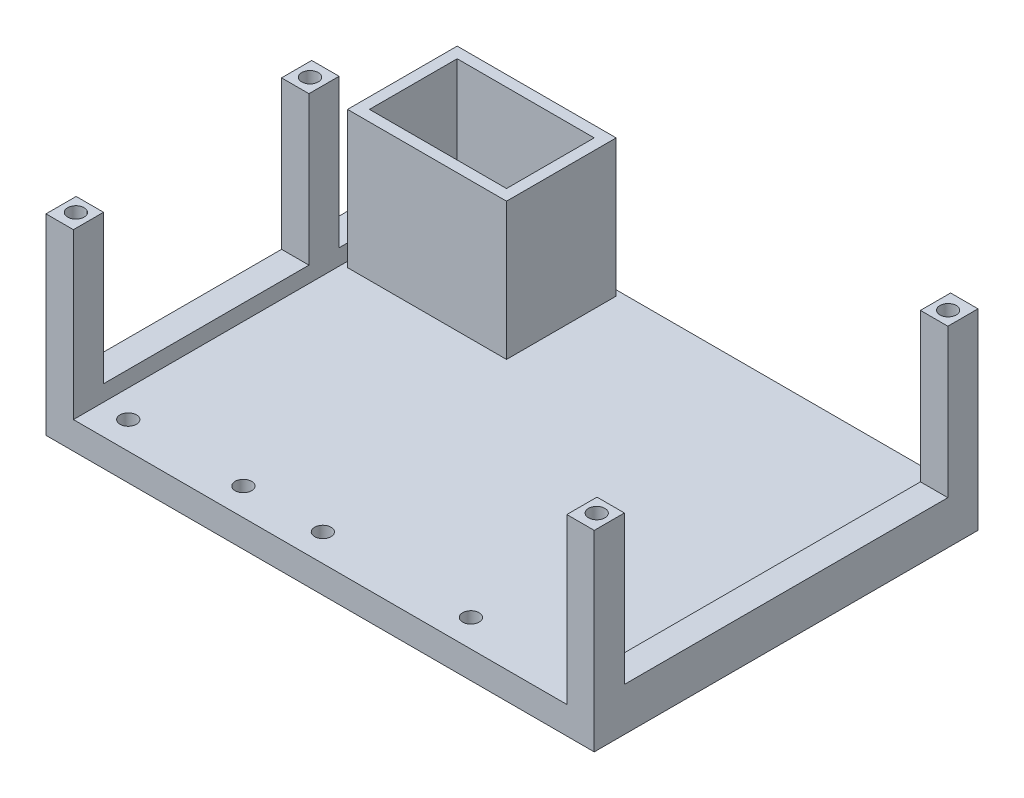
from build123d import *

# Parameters (mm, degrees)
SKETCH1_W               = 90
SKETCH1_H               = 70
BOSS_EXTRUDE1_DEPTH     = 2
SKETCH2_W               = 90
SKETCH2_H               = 70
BOSS_EXTRUDE2_DEPTH     = 5
CUT_EXTRUDE2_START      = -2
SKETCH3_R               = 1.5
CUT_EXTRUDE2_DEPTH      = 5
SKETCH9_W               = 5
SKETCH9_H               = 70
BOSS_EXTRUDE6_DEPTH     = 2
SKETCH9_2_W             = 5
SKETCH9_2_H             = 70
BOSS_EXTRUDE7_DEPTH     = 30
SKETCH11_R              = 1.5
CUT_EXTRUDE6_DEPTH      = 69.007352544
CUT_EXTRUDE7_DEPTH      = 111.675200474
CUT_EXTRUDE7_DEPTH_BACK = 10
BOSS_EXTRUDE8_START     = -2
SKETCH12_W              = 29
SKETCH12_H              = 20
BOSS_EXTRUDE8_DEPTH     = 25
SKETCH13_W              = 25
SKETCH13_H              = 16
CUT_EXTRUDE8_DEPTH      = 25
SKETCH14_W              = 21.535675489
SKETCH14_H              = 27.087328124
SKETCH14_W_2            = 37.464324511
CUT_EXTRUDE9_DEPTH      = 25
SKETCH15_R              = 1.5
CUT_EXTRUDE10_DEPTH     = 25
BOSS_EXTRUDE9_START     = -3
SKETCH16_W              = 5
SKETCH16_H              = 70
BOSS_EXTRUDE9_DEPTH     = 3


with BuildPart() as part:
    # Sketch1 → Boss-Extrude1 (new body)
    with BuildSketch(Plane(origin=(0, 0, 0), x_dir=(1, 0, 0), z_dir=(0, 1, 0))):
        Rectangle(SKETCH1_W, SKETCH1_H)
    extrude(amount=BOSS_EXTRUDE1_DEPTH)

    # Sketch2 → Boss-Extrude2 (add)
    with BuildSketch(Plane(origin=(0, 2, 0), x_dir=(1, 0, 0), z_dir=(0, 1, 0))):
        Rectangle(SKETCH2_W, SKETCH2_H)
    extrude(amount=-BOSS_EXTRUDE2_DEPTH)

    # Sketch3 → Cut-Extrude2 (cut)
    with BuildSketch(Plane.XZ.offset(CUT_EXTRUDE2_START)):
        with Locations(Location((-40, 30, 0), (0, 0, 90))):
            Circle(SKETCH3_R)
        with Locations(Location((-19, 30, 0), (0, 0, 90))):
            Circle(SKETCH3_R)
        with Locations(Location((-4.5, 30, 0), (0, 0, 90))):
            Circle(SKETCH3_R)
        with Locations(Location((22.5, 30, 0), (0, 0, 90))):
            Circle(SKETCH3_R)
    extrude(amount=CUT_EXTRUDE2_DEPTH, mode=Mode.SUBTRACT)

    # Sketch9 → Boss-Extrude6 (add)
    with BuildSketch(Plane(origin=(0, 2, 0), x_dir=(1, 0, 0), z_dir=(0, 1, 0))):
        with Locations((-47.5, 0)):
            Rectangle(SKETCH9_W, SKETCH9_H)
        with Locations((47.5, 0)):
            Rectangle(SKETCH9_W, SKETCH9_H)
    extrude(amount=-BOSS_EXTRUDE6_DEPTH)

    # Sketch9<2> → Boss-Extrude7 (add)
    with BuildSketch(Plane(origin=(0, 2, 0), x_dir=(1, 0, 0), z_dir=(0, 1, 0))):
        with Locations((-47.5, 0)):
            Rectangle(SKETCH9_2_W, SKETCH9_2_H)
        with Locations((47.5, 0)):
            Rectangle(SKETCH9_2_W, SKETCH9_2_H)
    extrude(amount=BOSS_EXTRUDE7_DEPTH)

    # Sketch11 → Cut-Extrude6 (cut, through all)
    with BuildSketch(Plane(origin=(0, 2, 0), x_dir=(1, 0, 0), z_dir=(0, 1, 0))):
        with Locations(Location((-47.5, -32.049006617, 0), (0, 0, 270))):
            Circle(SKETCH11_R)
        with Locations(Location((-47.5, 32.049006617, 0), (0, 0, 90))):
            Circle(SKETCH11_R)
        with Locations(Location((47.5, 32.049006617, 0), (0, 0, 270))):
            Circle(SKETCH11_R)
        with Locations(Location((47.5, -32.049006617, 0), (0, 0, 90))):
            Circle(SKETCH11_R)
    extrude(amount=CUT_EXTRUDE6_DEPTH, mode=Mode.SUBTRACT)

    # Sketch10 → Cut-Extrude7 (cut, two sides: drawn at the far end of the back side and taken through both)
    with BuildSketch(Plane(origin=(50, 0, 0), x_dir=(0, 0, -1), z_dir=(1, 0, 0)).offset(-CUT_EXTRUDE7_DEPTH_BACK)):
        Polygon((-29.5, 26.895487084), (-29.5, 7.104512916), (-29.5, 4.912671876), (29.5, 4.912671876), (29.5, 29.087328124), (29.5, 32), (-29.5, 32), (-29.5, 29.087328124), align=None)
    extrude(amount=CUT_EXTRUDE7_DEPTH + CUT_EXTRUDE7_DEPTH_BACK, mode=Mode.SUBTRACT)

    # Sketch12 → Boss-Extrude8 (add)
    with BuildSketch(Plane.XZ.offset(BOSS_EXTRUDE8_START)):
        with Locations((-29.5, -24)):
            Rectangle(SKETCH12_W, SKETCH12_H)
    extrude(amount=-BOSS_EXTRUDE8_DEPTH)

    # Sketch13 → Cut-Extrude8 (cut)
    with BuildSketch(Plane(origin=(0, 27, 0), x_dir=(-1, 0, 0), z_dir=(0, 1, 0))):
        with Locations((29.5, -24)):
            Rectangle(SKETCH13_W, SKETCH13_H)
    extrude(amount=-CUT_EXTRUDE8_DEPTH, mode=Mode.SUBTRACT)

    # Sketch14 → Cut-Extrude9 (cut)
    with BuildSketch(Plane(origin=(-45, 0, 0), x_dir=(0, 0, -1), z_dir=(1, 0, 0))):
        with Locations((24.232162256, 18.456335938)):
            Rectangle(SKETCH14_W, SKETCH14_H)
        with Locations((-10.767837745, 18.456335938)):
            Rectangle(SKETCH14_W_2, SKETCH14_H)
    extrude(amount=-CUT_EXTRUDE9_DEPTH, mode=Mode.SUBTRACT)

    # Sketch15 → Cut-Extrude10 (cut)
    with BuildSketch(Plane(origin=(0, 32, 0), x_dir=(1, 0, 0), z_dir=(0, 1, 0))):
        with Locations(Location((-47.5, 10.653576943, 0), (0, 0, 270))):
            Circle(SKETCH15_R)
    extrude(amount=-CUT_EXTRUDE10_DEPTH, mode=Mode.SUBTRACT)

    # Sketch16 → Boss-Extrude9 (add)
    with BuildSketch(Plane.XZ.offset(3).offset(BOSS_EXTRUDE9_START)):
        with Locations((-47.5, 0)):
            Rectangle(SKETCH16_W, SKETCH16_H)
        with Locations((47.5, 0)):
            Rectangle(SKETCH16_W, SKETCH16_H)
    extrude(amount=BOSS_EXTRUDE9_DEPTH)


solid = part.part
